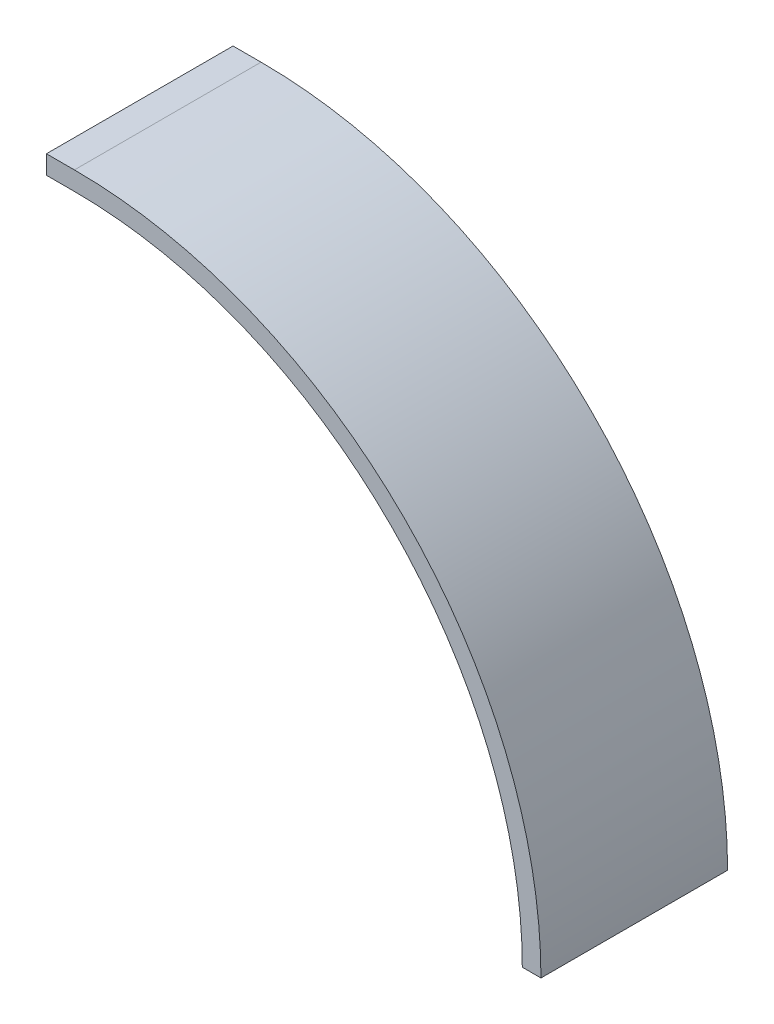
from build123d import *

# Parameters (mm, degrees)
BOSS_EXTRUDE1_DEPTH = 20
SKETCH2_W           = 20
SKETCH2_H           = 2
BOSS_EXTRUDE2_DEPTH = 3


with BuildPart() as part:
    # Sketch1 → Boss-Extrude1 (new body)
    with BuildSketch(Plane.XY):
        with BuildLine():
            Line((-45.486032275, 0.959524002), (-45.486032275, -1.040475998))
            ThreePointArc((-45.486032275, -1.040475998), (-11.544906778, -15.099350501), (2.513967725, -49.040475998))
            Line((2.513967725, -49.040475998), (4.513967725, -49.040475998))
            ThreePointArc((4.513967725, -49.040475998), (-10.130693215, -13.685136939), (-45.486032275, 0.959524002))
        make_face()
    extrude(amount=BOSS_EXTRUDE1_DEPTH)

    # Sketch2 → Boss-Extrude2 (add)
    with BuildSketch(Plane.ZY.offset(45.486032275)):
        with Locations((10, -0.040475998)):
            Rectangle(SKETCH2_W, SKETCH2_H)
    extrude(amount=BOSS_EXTRUDE2_DEPTH)


solid = part.part
